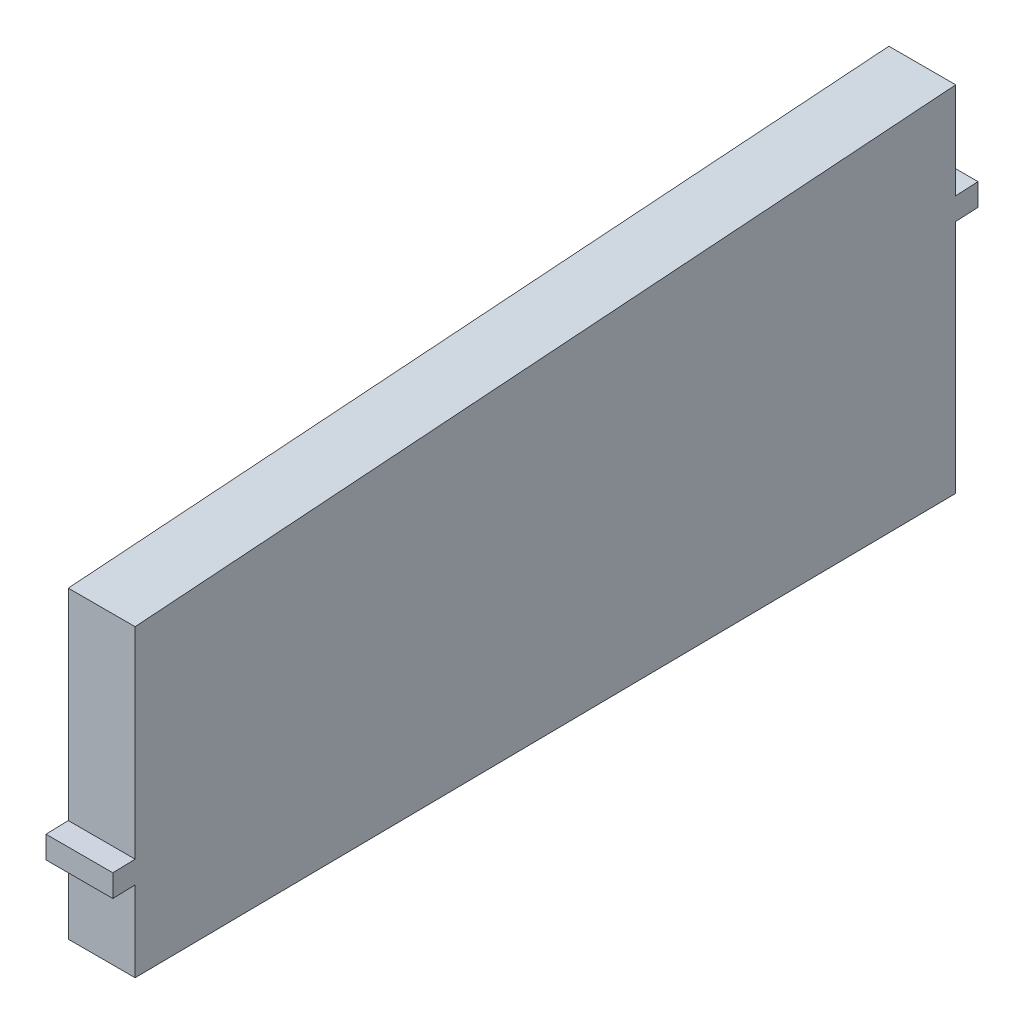
from build123d import *

# Parameters (mm, degrees)
BOSS_EXTRUDE1_DEPTH = 9.525


with BuildPart() as part:
    # Sketch1 → Boss-Extrude1 (new body)
    with BuildSketch(Plane(origin=(243.017706631, 0, 0), x_dir=(0, 0, -1), z_dir=(1, 0, 0))):
        Polygon((-1020.29786066, 373.753565461), (-1020.29786066, 370.578565461), (-1017.12286066, 370.67477618), (-1017.12286066, 359.209569565), (-900.177027496, 360.518497171), (-900.177027496, 394.071183288), (-897.002027496, 394.238773631), (-897.002027496, 397.413773631), (-900.177027496, 397.246183288), (-900.177027496, 410.946223778), (-1017.12286066, 402.538478922), (-1017.12286066, 373.84977618), align=None)
    extrude(amount=BOSS_EXTRUDE1_DEPTH)


solid = part.part
